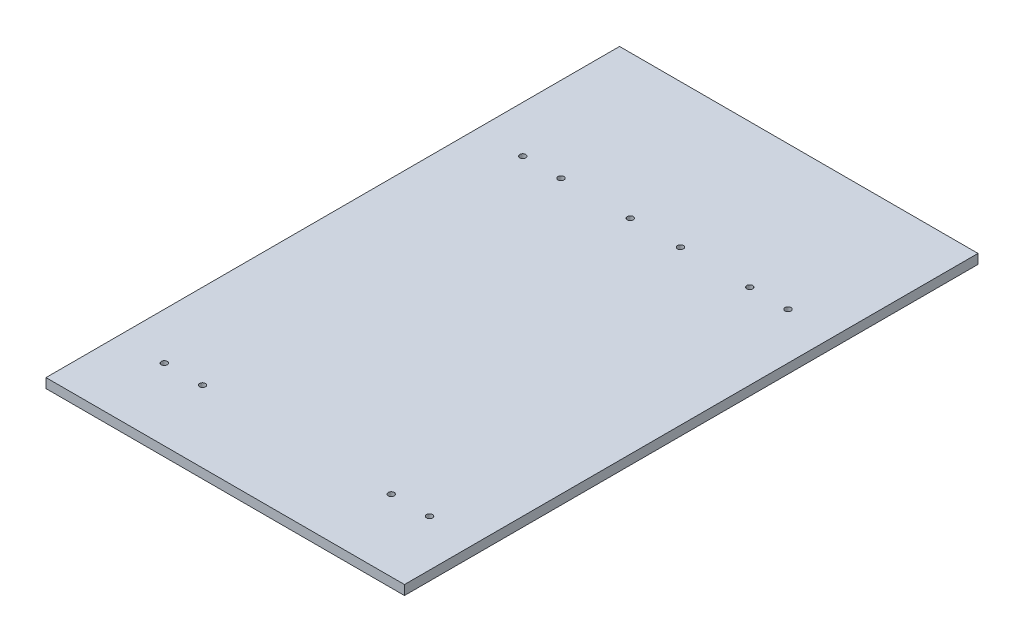
from build123d import *

# Parameters (mm, degrees)
SKETCH1_W           = 300
SKETCH1_H           = 480
SKETCH1_R           = 2.5
BOSS_EXTRUDE1_DEPTH = 8


with BuildPart() as part:
    # Sketch1 → Boss-Extrude1 (new body)
    with BuildSketch(Plane(origin=(0, 0, 0), x_dir=(1, 0, 0), z_dir=(0, 1, 0))):
        Rectangle(SKETCH1_W, SKETCH1_H)
        with Locations(Location((-111, 120, 0), (0, 0, 270))):
            Circle(SKETCH1_R, mode=Mode.SUBTRACT)
        with Locations(Location((-111, -180, 0), (0, 0, 270))):
            Circle(SKETCH1_R, mode=Mode.SUBTRACT)
        with Locations(Location((-79, -180, 0), (0, 0, 90))):
            Circle(SKETCH1_R, mode=Mode.SUBTRACT)
        with Locations(Location((-79, 120, 0), (0, 0, 90))):
            Circle(SKETCH1_R, mode=Mode.SUBTRACT)
        with Locations(Location((79, -180, 0), (0, 0, 270))):
            Circle(SKETCH1_R, mode=Mode.SUBTRACT)
        with Locations(Location((111, -180, 0), (0, 0, 90))):
            Circle(SKETCH1_R, mode=Mode.SUBTRACT)
        with Locations(Location((79, 120, 0), (0, 0, 270))):
            Circle(SKETCH1_R, mode=Mode.SUBTRACT)
        with Locations(Location((111, 120, 0), (0, 0, 90))):
            Circle(SKETCH1_R, mode=Mode.SUBTRACT)
        with Locations(Location((-21, 120, 0), (0, 0, 270))):
            Circle(SKETCH1_R, mode=Mode.SUBTRACT)
        with Locations(Location((21, 120, 0), (0, 0, 90))):
            Circle(SKETCH1_R, mode=Mode.SUBTRACT)
    extrude(amount=BOSS_EXTRUDE1_DEPTH)


solid = part.part
